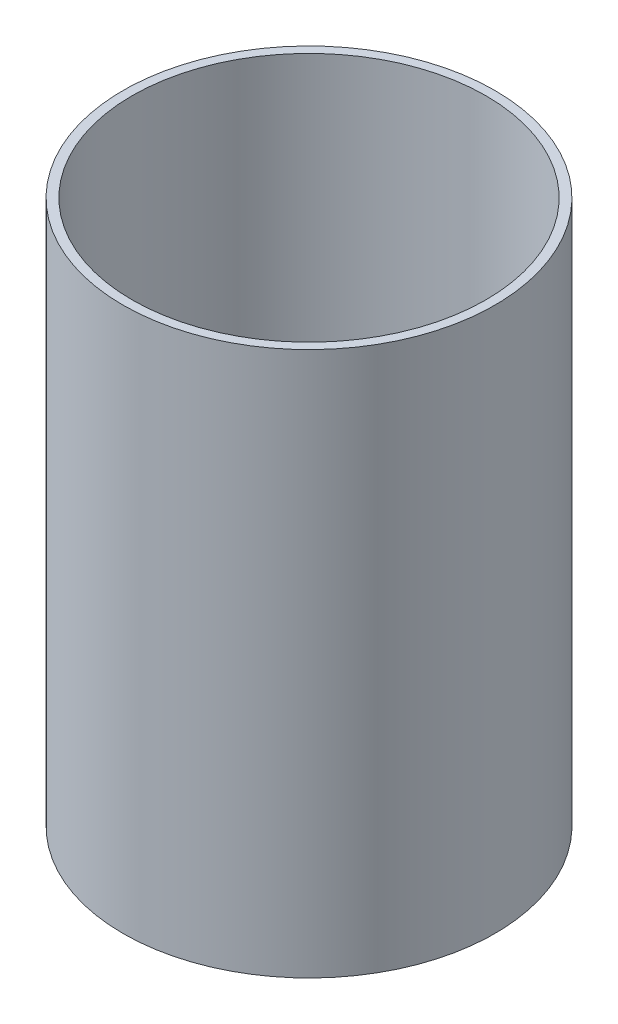
from build123d import *

# Parameters (mm, degrees)
SKETCH1_W                = 5
SKETCH1_H                = 300
BOSS_EXTRUDE1_DEPTH      = 5
BOSS_EXTRUDE1_DEPTH_BACK = 5
CIRPATTERN1_COUNT        = 4
SKETCH4_R                = 5
CUT_EXTRUDE1_DEPTH       = 100


with BuildPart() as part:
    # Sketch1 → Revolve-Thin1 (revolve)
    with BuildSketch(Plane(origin=(0, 0, 0), x_dir=(0, 0, -1), z_dir=(1, 0, 0))):
        with Locations((100, 150)):
            Rectangle(SKETCH1_W, SKETCH1_H)
    revolve(axis=Axis((0, 0, 0), (0, 1, 0)))

    # Sketch4 → Cut-Extrude1 (cut)
    with BuildSketch(Plane(origin=(0, 0, 0), x_dir=(0, 0, -1), z_dir=(1, 0, 0))):
        with Locations(Location((0, 150, 0), (0, 0, 180))):
            Circle(SKETCH4_R)
    extrude(amount=CUT_EXTRUDE1_DEPTH, mode=Mode.SUBTRACT)


with BuildPart() as body_2:
    # Sketch3 → Boss-Extrude1 (new, two sides: drawn at the far end of the back side and taken through both)
    with BuildSketch(Plane(origin=(0, 0, 0), x_dir=(0, 0, -1), z_dir=(1, 0, 0)).offset(-BOSS_EXTRUDE1_DEPTH_BACK)):
        Polygon((97.5, 100), (97.5, 80), (87.5, 100), align=None)
    extrude(amount=BOSS_EXTRUDE1_DEPTH + BOSS_EXTRUDE1_DEPTH_BACK)


with BuildPart() as cirpattern1_1:
    # CirPattern1: pattern copy
    add(body_2.part.rotate(Axis((0, 0, 0), (0, 1, 0)), 1 * 360 / CIRPATTERN1_COUNT))


with BuildPart() as cirpattern1_2:
    # CirPattern1: pattern copy
    add(body_2.part.rotate(Axis((0, 0, 0), (0, 1, 0)), 2 * 360 / CIRPATTERN1_COUNT))


with BuildPart() as cirpattern1_3:
    # CirPattern1: pattern copy
    add(body_2.part.rotate(Axis((0, 0, 0), (0, 1, 0)), 3 * 360 / CIRPATTERN1_COUNT))


solid = Compound([part.part, body_2.part, cirpattern1_1.part, cirpattern1_2.part, cirpattern1_3.part])
